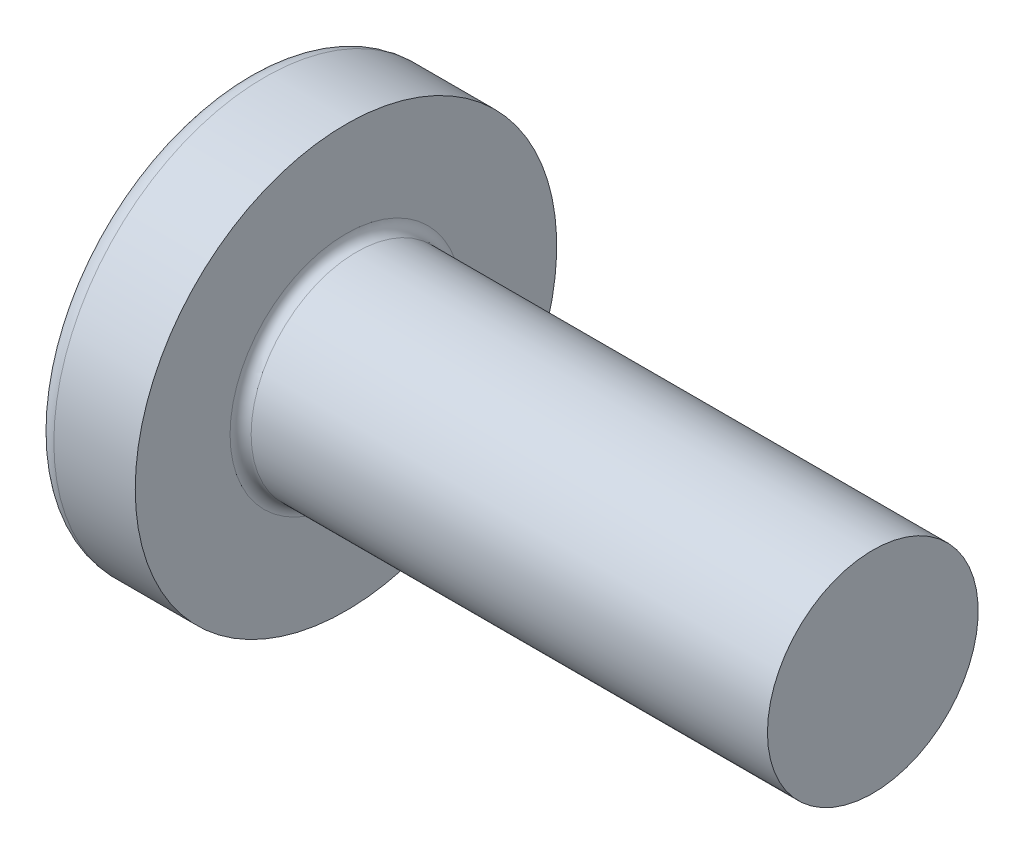
from build123d import *

# Parameters (mm, degrees)
FILLET1_R    = 0.2
RECPAT_COUNT = 2
RECPAT_ANGLE = 90


with BuildPart() as part:
    # BodySke → Base-Revolve (revolve)
    with BuildSketch(Plane.XY, mode=Mode.PRIVATE) as base_revolve_sk:
        with BuildLine():
            Line((3.1, 2), (3.1, 4))
            Line((3.1, 4), (1.555305874, 4))
            ThreePointArc((1.555305874, 4), (1.392873227, 3.961271902), (1.265388955, 3.853420195))
            ThreePointArc((1.265388955, 3.853420195), (0.324444487, 2.027933456), (0, 0))
            Line((0, 0), (13.1, 0))
            Line((13.1, 0), (13.1, 2))
            Line((13.1, 2), (3.1, 2))
        make_face()
    revolve(base_revolve_sk.sketch.rotate(Axis((1.555305874, 0, 0), (1, 0, 0)), 90), axis=Axis((1.555305874, 0, 0), (1, 0, 0)))

    # Fillet1
    fillet1_edges = [part.edges().sort_by_distance(p)[0] for p in [
        (3.1, 0, -2),
    ]]
    fillet(fillet1_edges, radius=FILLET1_R)

    # Sketch3 → Recess section 0
    with BuildSketch(Plane(origin=(0, 0, 0), x_dir=(0, 0, -1), z_dir=(1, 0, 0))):
        with BuildLine():
            Line((0.515, -2.15), (-0.515, -2.15))
            Line((-0.515, -2.15), (-0.515, 2.15))
            Line((-0.515, 2.15), (0.515, 2.15))
            Line((0.515, 2.15), (0.515, -2.15))
        make_face()
    # Sketch4 → Recess section 1
    with BuildSketch(Plane(origin=(2.34, 0, 0), x_dir=(0, 0, -1), z_dir=(1, 0, 0))):
        with BuildLine():
            Line((0.515, -0.983319232), (-0.515, -0.983319232))
            Line((-0.515, -0.983319232), (-0.515, 0.983319232))
            Line((-0.515, 0.983319232), (0.515, 0.983319232))
            Line((0.515, 0.983319232), (0.515, -0.983319232))
        make_face()
    recess = loft(mode=Mode.SUBTRACT)

    # RecPat: Recess ×2 about axis
    recpat_axis = Axis((0, 0, 0), (1, 0, 0))
    for i in range(1, RECPAT_COUNT):
        add(recess.rotate(recpat_axis, i * RECPAT_ANGLE / (RECPAT_COUNT - 1)), mode=Mode.SUBTRACT)

    # RecCorSke → RecessCore (revolve, cut)
    with BuildSketch(Plane.XY, mode=Mode.PRIVATE) as recesscore_sk:
        Polygon((0, 0), (0, 1.01462874), (2.34, 0.851), (2.616506661, 0), align=None)
    revolve(recesscore_sk.sketch.rotate(Axis((-3.175, 0, 0), (1, 0, 0)), 345.452408241), axis=Axis((-3.175, 0, 0), (1, 0, 0)), mode=Mode.SUBTRACT)


solid = part.part
